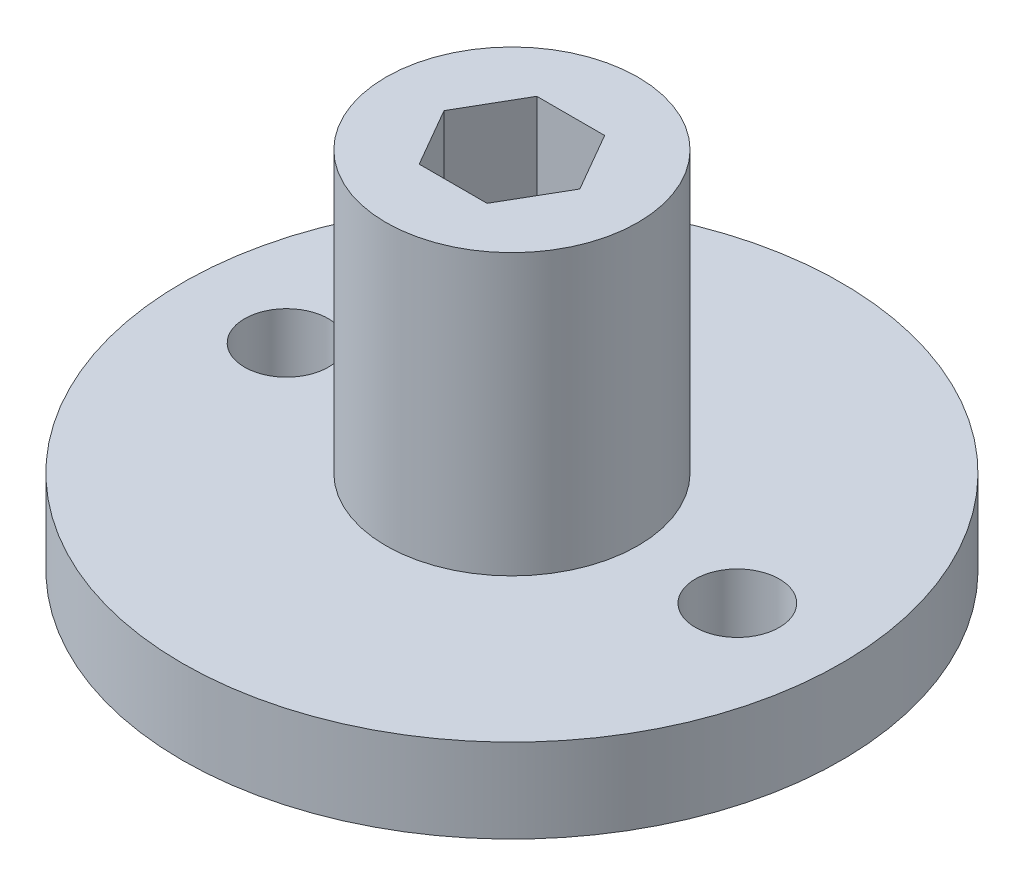
from build123d import *

# Parameters (mm, degrees)
SKETCH1_R           = 11.7729
SKETCH1_R_2         = 1.016
BOSS_EXTRUDE1_DEPTH = 3
SKETCH2_R           = 1.5
CUT_EXTRUDE1_DEPTH  = 17.917516036
SKETCH4_R           = 3
CUT_EXTRUDE3_DEPTH  = 1.5
SKETCH6_R           = 4.5
BOSS_EXTRUDE4_DEPTH = 10
CUT_EXTRUDE4_DEPTH  = 20.421697887


with BuildPart() as part:
    # Sketch1 → Boss-Extrude1 (new body)
    with BuildSketch(Plane(origin=(0, 0, 0), x_dir=(1, 0, 0), z_dir=(0, 1, 0))):
        with Locations(Location((0, 0, 0), (0, 0, 270))):
            Circle(SKETCH1_R)
        with Locations(Location((0, 0, 0), (0, 0, 270))):
            Circle(SKETCH1_R_2, mode=Mode.SUBTRACT)
    extrude(amount=BOSS_EXTRUDE1_DEPTH)

    # Sketch2 → Cut-Extrude1 (cut, through all)
    with BuildSketch(Plane(origin=(0, 3, 0), x_dir=(1, 0, 0), z_dir=(0, 1, 0))):
        with Locations(Location((8.0518, 0, 0), (0, 0, 270))):
            Circle(SKETCH2_R)
        with Locations(Location((-8.0518, 0, 0), (0, 0, 270))):
            Circle(SKETCH2_R)
    extrude(amount=-CUT_EXTRUDE1_DEPTH, mode=Mode.SUBTRACT)

    # Sketch4 → Cut-Extrude3 (cut)
    with BuildSketch(Plane.XZ):
        with Locations(Location((0, 0, 0), (0, 0, 270))):
            Circle(SKETCH4_R)
    extrude(amount=-CUT_EXTRUDE3_DEPTH, mode=Mode.SUBTRACT)

    # Sketch6 → Boss-Extrude4 (add)
    with BuildSketch(Plane(origin=(0, 3, 0), x_dir=(1, 0, 0), z_dir=(0, 1, 0))):
        with Locations(Location((0, 0, 0), (0, 0, 270))):
            Circle(SKETCH6_R)
    extrude(amount=BOSS_EXTRUDE4_DEPTH)

    # Sketch7 → Cut-Extrude4 (cut, through all)
    with BuildSketch(Plane.XZ.offset(-3)):
        Polygon((2.424871131, 0), (1.212435565, 2.1), (-1.212435565, 2.1), (-2.424871131, 0), (-1.212435565, -2.1), (1.212435565, -2.1), align=None)
    extrude(amount=-CUT_EXTRUDE4_DEPTH, mode=Mode.SUBTRACT)


solid = part.part
